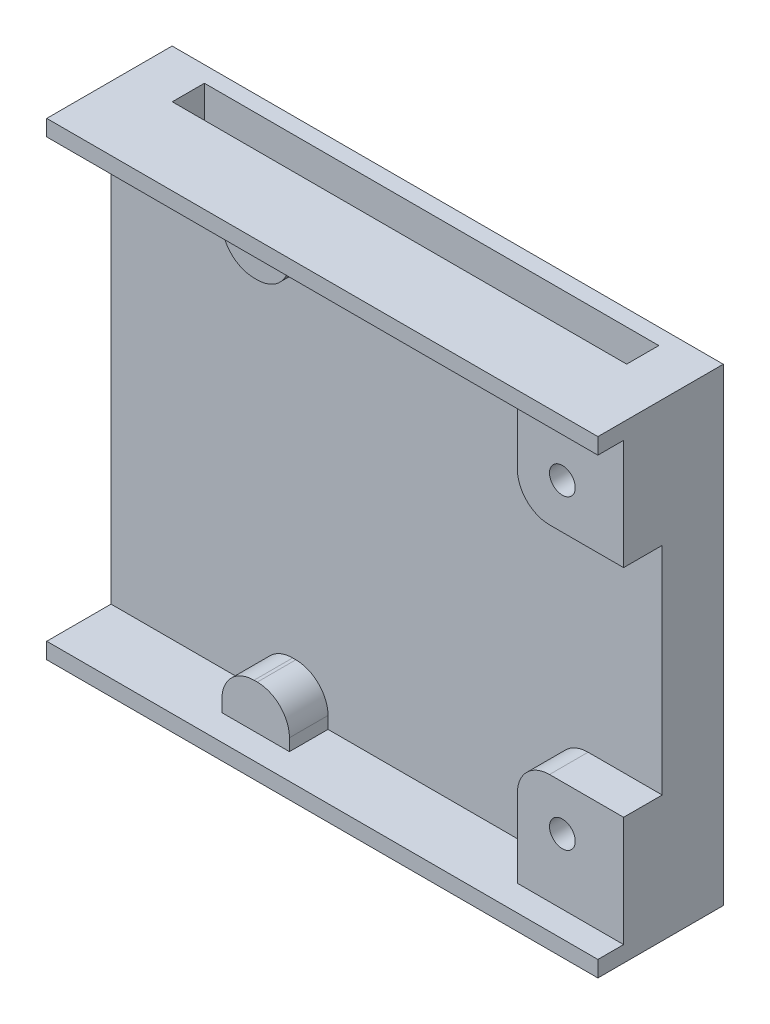
from build123d import *

# Parameters (mm, degrees)
SKETCH2_W               = 29.17
SKETCH2_H               = 34.29
BOSS_EXTRUDE1_DEPTH     = 0.8
SKETCH4_W               = 4.2
SKETCH4_H               = 2.75
SKETCH4_W_2             = 6.61
SKETCH4_H_2             = 6.86
BOSS_EXTRUDE3_DEPTH     = 2.4
SKETCH5_W               = 34.29
SKETCH5_H               = 1
BOSS_EXTRUDE5_DEPTH     = 4
SKETCH6_W               = 3.01
SKETCH6_H               = 29.17
BOSS_EXTRUDE6_DEPTH     = 2
CUT_EXTRUDE1_DEPTH      = 24.10223474
CUT_EXTRUDE1_DEPTH_BACK = 24.10223474
SKETCH8_R               = 0.8
SKETCH9_W               = 34.29
SKETCH9_H               = 29.17
SKETCH9_W_2             = 28.27
SKETCH9_H_2             = 23.15
BOSS_EXTRUDE8_DEPTH     = 1
FILLET1_R               = 2


with BuildPart() as part:
    # Sketch2 → Boss-Extrude1 (new body)
    with BuildSketch(Plane(origin=(0, 0, 0), x_dir=(0, 1, 0), z_dir=(0, 0, 1))):
        Rectangle(SKETCH2_W, SKETCH2_H)
    extrude(amount=BOSS_EXTRUDE1_DEPTH)

    # Sketch4 → Boss-Extrude3 (add)
    with BuildSketch(Plane.XY.offset(0.8)):
        with Locations((-5.745, -12.21)):
            Rectangle(SKETCH4_W, SKETCH4_H)
        with Locations((13.84, -10.155)):
            Rectangle(SKETCH4_W_2, SKETCH4_H_2)
        with Locations((13.84, 10.155)):
            Rectangle(SKETCH4_W_2, SKETCH4_H_2)
        with Locations((-5.745, 12.21)):
            Rectangle(SKETCH4_W, SKETCH4_H)
    extrude(amount=BOSS_EXTRUDE3_DEPTH)

    # Sketch5 → Boss-Extrude5 (add)
    with BuildSketch(Plane.XY.offset(0.8)):
        with Locations((0, 14.085)):
            Rectangle(SKETCH5_W, SKETCH5_H)
        with Locations((0, -14.085)):
            Rectangle(SKETCH5_W, SKETCH5_H)
    extrude(amount=BOSS_EXTRUDE5_DEPTH)

    # Sketch6 → Boss-Extrude6 (add)
    with BuildSketch(Plane(origin=(0, 0, 0), x_dir=(1, 0, 0), z_dir=(0, 0, -1))):
        with Locations((15.64, 0)):
            Rectangle(SKETCH6_W, SKETCH6_H)
        with Locations((-15.64, 0)):
            Rectangle(SKETCH6_W, SKETCH6_H)
    extrude(amount=BOSS_EXTRUDE6_DEPTH)

    # Sketch8 → Cut-Extrude1 (cut, two sides: drawn at the far end of the back side and taken through both)
    with BuildSketch(Plane.XY.offset(3.2).offset(-CUT_EXTRUDE1_DEPTH_BACK)):
        with Locations((13.335, 9.525)):
            Circle(SKETCH8_R)
        with Locations((13.335, -9.525)):
            Circle(SKETCH8_R)
    extrude(amount=CUT_EXTRUDE1_DEPTH + CUT_EXTRUDE1_DEPTH_BACK, mode=Mode.SUBTRACT)

    # Sketch9 → Boss-Extrude8 (add)
    with BuildSketch(Plane(origin=(0, 0, -2), x_dir=(1, 0, 0), z_dir=(0, 0, -1))):
        Rectangle(SKETCH9_W, SKETCH9_H)
        Rectangle(SKETCH9_W_2, SKETCH9_H_2, mode=Mode.SUBTRACT)
    extrude(amount=BOSS_EXTRUDE8_DEPTH)

    # Fillet1
    fillet1_edges = [part.edges().sort_by_distance(p)[0] for p in [
        (-7.845, 10.835, 2),
        (-3.645, 10.835, 2),
        (10.535, 6.725, 2),
        (10.535, -6.725, 2),
        (-3.645, -10.835, 2),
        (-7.845, -10.835, 2),
    ]]
    fillet(fillet1_edges, radius=FILLET1_R)


solid = part.part
